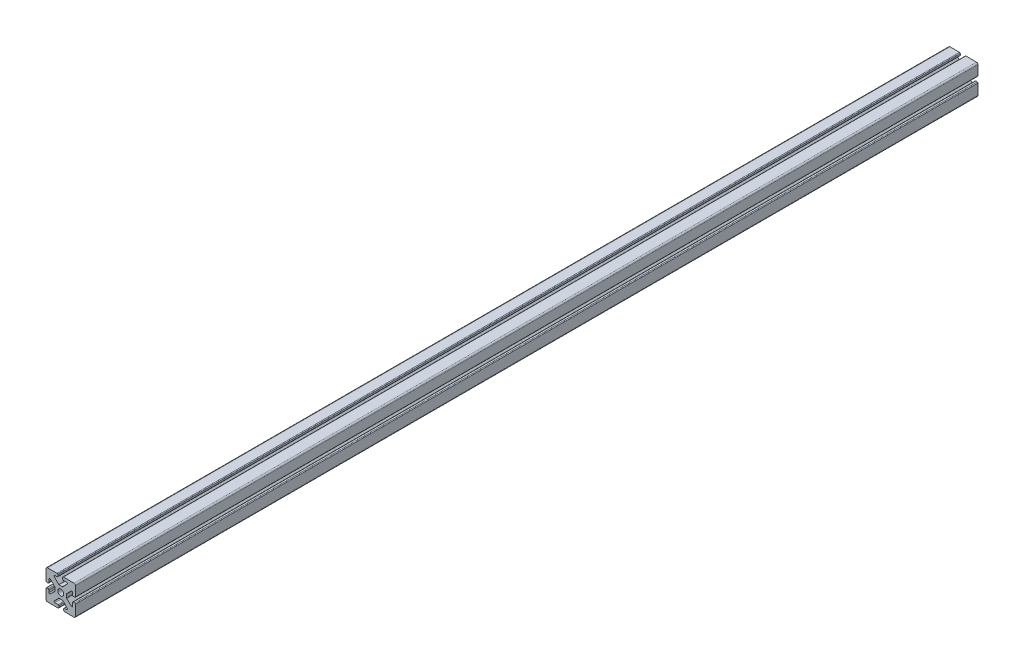
from build123d import *

# Parameters (mm, degrees)
SKETCH_1_W               = 40
SKETCH_1_H               = 40
EXTRUDE_1_DEPTH          = 1223
SKETCH_2_R               = 4.05
CUT_EXTRUDE_1_DEPTH      = 10000
CUT_EXTRUDE_2_DEPTH      = 10000
FILLET_1_R               = 1
PATTERN_CIRCULAR_2_COUNT = 4
FILLET_2_R               = 1
FILLET_3_R               = 1
FILLET_4_R               = 1
FILLET_5_R               = 2


with BuildPart() as part:
    # 草图1 → 凸台-拉伸1 (new body)
    with BuildSketch(Plane.XY):
        Rectangle(SKETCH_1_W, SKETCH_1_H)
    extrude(amount=EXTRUDE_1_DEPTH)

    # 草图2 → 切除-拉伸1 (cut)
    with BuildSketch(Plane.XY.offset(1223)):
        Circle(SKETCH_2_R)
    extrude(amount=-CUT_EXTRUDE_1_DEPTH, mode=Mode.SUBTRACT)

    # 草图4 → 切除-拉伸2 (cut)
    with BuildSketch(Plane.XY.offset(1223)):
        Polygon((20, 0), (20, 4), (16, 4), (16, 10.5), (7.876860985, 2.6), (7.876860985, -2.6), (16, -10.5), (16, -2.65197969), (20, -2.65197969), align=None)
    cut_extrude_2 = extrude(amount=-CUT_EXTRUDE_2_DEPTH, mode=Mode.SUBTRACT)

    # 圆角1
    fillet_1_edges = [part.edges().sort_by_distance(p)[0] for p in [
        (20, -2.65197969, 611.5),
        (16, -2.65197969, 611.5),
        (16, -10.5, 611.5),
        (7.876860985, -2.6, 611.5),
        (7.876860985, 2.6, 611.5),
        (16, 10.5, 611.5),
        (16, 4, 611.5),
        (20, 4, 611.5),
    ]]
    fillet(fillet_1_edges, radius=FILLET_1_R)

    # 阵列(圆周)2: 切除-拉伸2 ×4 about axis
    pattern_circular_2_axis = Axis((0, 0, 0), (0, 0, 1))
    for i in range(1, PATTERN_CIRCULAR_2_COUNT):
        add(cut_extrude_2.rotate(pattern_circular_2_axis, i * 360 / PATTERN_CIRCULAR_2_COUNT), mode=Mode.SUBTRACT)

    # 圆角2
    fillet_2_edges = [part.edges().sort_by_distance(p)[0] for p in [
        (2.65197969, 20, 611.5),
        (2.65197969, 16, 611.5),
        (10.5, 16, 611.5),
        (2.6, 7.876860985, 611.5),
        (-2.6, 7.876860985, 611.5),
        (-10.5, 16, 611.5),
        (-4, 16, 611.5),
        (-4, 20, 611.5),
    ]]
    fillet(fillet_2_edges, radius=FILLET_2_R)

    # 圆角3
    fillet_3_edges = [part.edges().sort_by_distance(p)[0] for p in [
        (-20, 2.65197969, 611.5),
        (-16, 2.65197969, 611.5),
        (-16, 10.5, 611.5),
        (-7.876860985, 2.6, 611.5),
        (-7.876860985, -2.6, 611.5),
        (-16, -10.5, 611.5),
        (-16, -4, 611.5),
        (-20, -4, 611.5),
    ]]
    fillet(fillet_3_edges, radius=FILLET_3_R)

    # 圆角4
    fillet_4_edges = [part.edges().sort_by_distance(p)[0] for p in [
        (-2.65197969, -20, 611.5),
        (-2.65197969, -16, 611.5),
        (-10.5, -16, 611.5),
        (-2.6, -7.876860985, 611.5),
        (2.6, -7.876860985, 611.5),
        (10.5, -16, 611.5),
        (4, -16, 611.5),
        (4, -20, 611.5),
    ]]
    fillet(fillet_4_edges, radius=FILLET_4_R)

    # 圆角5
    fillet_5_edges = [part.edges().sort_by_distance(p)[0] for p in [
        (20, -20, 611.5),
        (-20, -20, 611.5),
        (-20, 20, 611.5),
        (20, 20, 611.5),
    ]]
    fillet(fillet_5_edges, radius=FILLET_5_R)


solid = part.part
